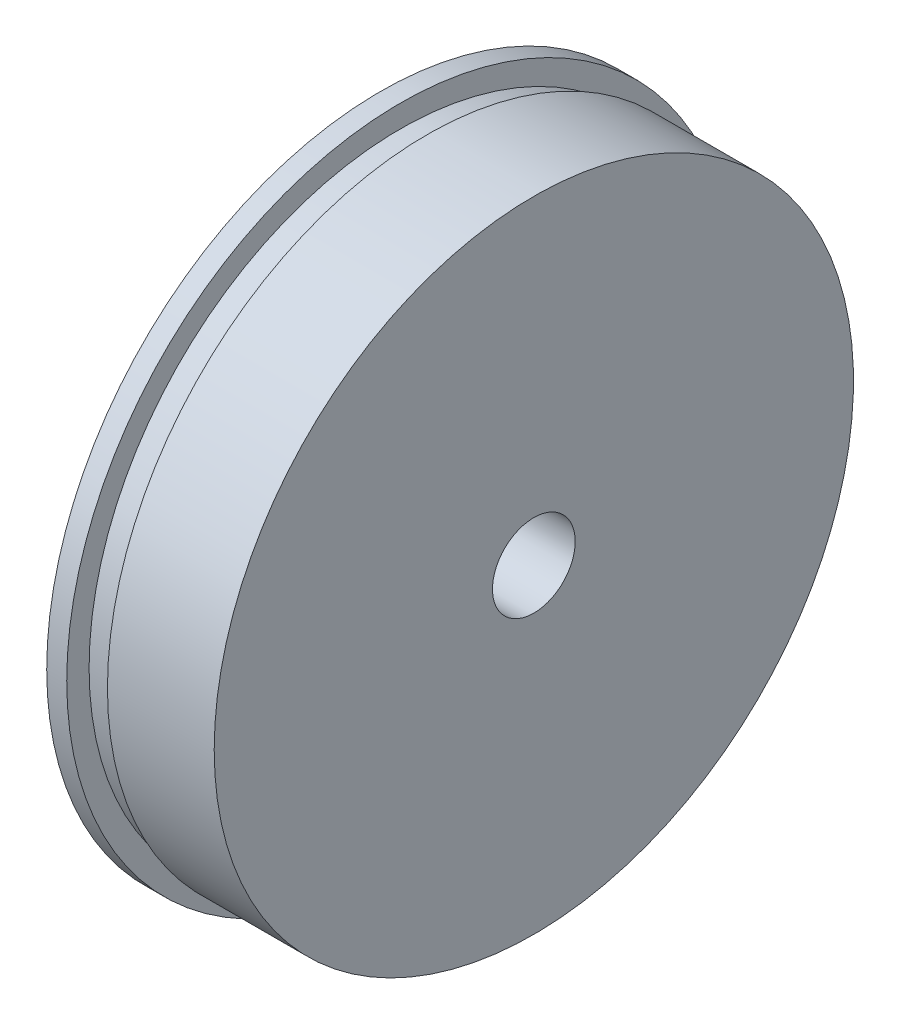
from build123d import *

# Parameters (mm, degrees)
SKETCH3_R          = 1.5748
CUT_EXTRUDE1_DEPTH = 19.886740428


with BuildPart() as part:
    # Sketch2 → Revolve1 (revolve)
    with BuildSketch(Plane.XY, mode=Mode.PRIVATE) as revolve1_sk:
        Polygon((0, 0), (0, -12.7), (0.762, -12.7), (0.762, -11.8491), (1.778, -11.8491), (1.778, -12.1666), (5.842, -12.1666), (5.842, 0), align=None)
    revolve(revolve1_sk.sketch.rotate(Axis((0, 0, 0), (1, 0, 0)), 270), axis=Axis((0, 0, 0), (1, 0, 0)))

    # Sketch3 → Cut-Extrude1 (cut, through all)
    with BuildSketch(Plane(origin=(5.842, 0, 0), x_dir=(0, 0, -1), z_dir=(1, 0, 0))):
        Circle(SKETCH3_R)
    extrude(amount=-CUT_EXTRUDE1_DEPTH, mode=Mode.SUBTRACT)


solid = part.part
